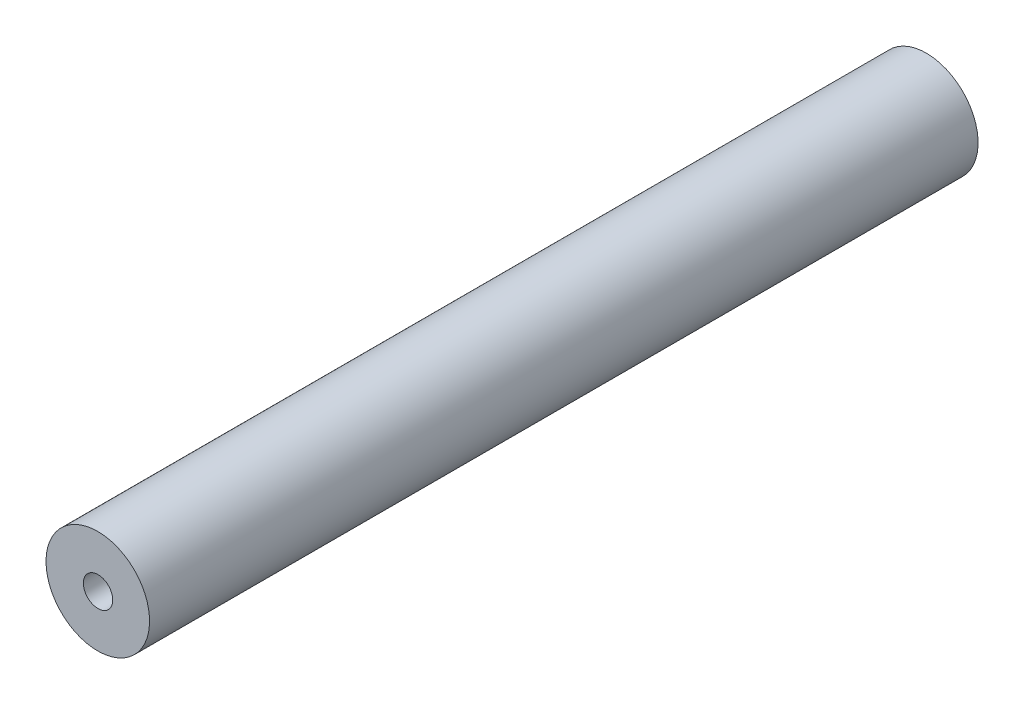
from build123d import *

# Parameters (mm, degrees)
SKETCH2_R                  = 4.7625
BOSS_EXTRUDE1_DEPTH        = 76.2
F_10_32_TAPPED_HOLE1_D     = 4.0386
F_10_32_TAPPED_HOLE1_DEPTH = 15.24
F_10_32_TAPPED_HOLE1_TIP   = 1.213317848
F_6_32_TAPPED_HOLE1_D      = 2.7051
F_6_32_TAPPED_HOLE1_DEPTH  = 9.398
F_6_32_TAPPED_HOLE1_TIP    = 0.81269403


with BuildPart() as part:
    # Sketch2 → Boss-Extrude1 (new body)
    with BuildSketch(Plane.XY):
        with Locations(Location((0, 0, 0), (0, 0, 180))):
            Circle(SKETCH2_R)
    extrude(amount=BOSS_EXTRUDE1_DEPTH)

    # #10-32 Tapped Hole1
    with Locations(Plane(origin=(0, 0, 0), x_dir=(-1, 0, 0), z_dir=(0, 0, -1))):
        with Locations((-0.028702786, 0.067410108)):
            Hole(F_10_32_TAPPED_HOLE1_D / 2, depth=F_10_32_TAPPED_HOLE1_DEPTH)
            with Locations((0, 0, -(F_10_32_TAPPED_HOLE1_DEPTH + F_10_32_TAPPED_HOLE1_TIP / 2))):  # 118° drill point
                Cone(0, F_10_32_TAPPED_HOLE1_D / 2, F_10_32_TAPPED_HOLE1_TIP, mode=Mode.SUBTRACT)

    # #6-32 Tapped Hole1
    with Locations(Plane.XY.offset(76.2)):
        with Locations((0.02374074, -0.015572073)):
            Hole(F_6_32_TAPPED_HOLE1_D / 2, depth=F_6_32_TAPPED_HOLE1_DEPTH)
            with Locations((0, 0, -(F_6_32_TAPPED_HOLE1_DEPTH + F_6_32_TAPPED_HOLE1_TIP / 2))):  # 118° drill point
                Cone(0, F_6_32_TAPPED_HOLE1_D / 2, F_6_32_TAPPED_HOLE1_TIP, mode=Mode.SUBTRACT)


solid = part.part
